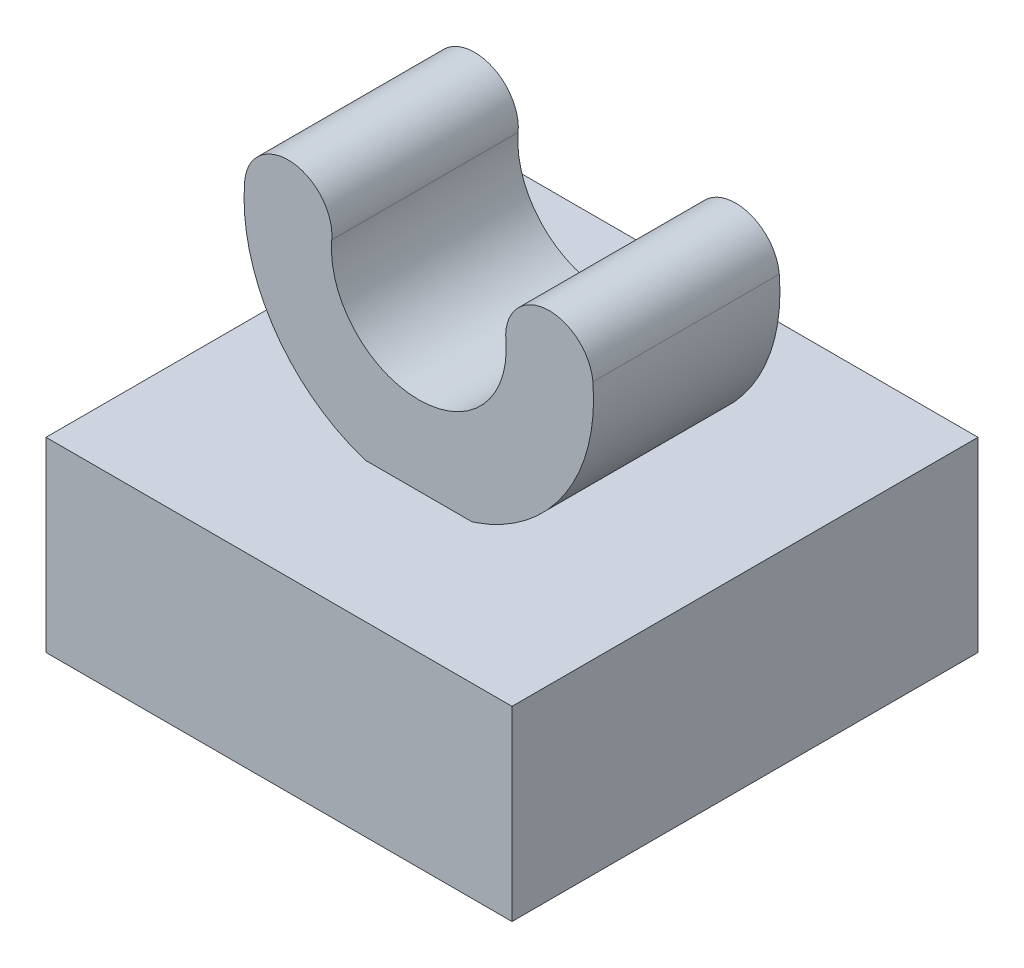
from build123d import *

# Parameters (mm, degrees)
BOSS_EXTRUDE1_DEPTH = 3.2
BOSS_EXTRUDE2_START = 1.6
SKETCH2_W           = 8
SKETCH2_H           = 3.2
BOSS_EXTRUDE2_DEPTH = 4
SKETCH3_W           = 4.8
SKETCH3_H           = 4.8
CUT_EXTRUDE1_DEPTH  = 1.8


with BuildPart() as part:
    # Sketch1 → Boss-Extrude1 (new body)
    with BuildSketch(Plane.XY):
        with BuildLine():
            ThreePointArc((-2.988584094, 0.261467228), (0, -3), (2.988584094, 0.261467228))
            ThreePointArc((2.988584094, 0.261467228), (2.176071264, 0.943246445), (1.494292047, 0.130733614))
            ThreePointArc((1.494292047, 0.130733614), (0, -1.5), (-1.494292047, 0.130733614))
            ThreePointArc((-1.494292047, 0.130733614), (-2.176071264, 0.943246445), (-2.988584094, 0.261467228))
        make_face()
    extrude(amount=BOSS_EXTRUDE1_DEPTH)


with BuildPart() as body_2:
    # Sketch2 → Boss-Extrude2 (new, symmetric)
    with BuildSketch(Plane.XY.offset(BOSS_EXTRUDE2_START)):
        with Locations((0, -4.456753555)):
            Rectangle(SKETCH2_W, SKETCH2_H)
    extrude(amount=BOSS_EXTRUDE2_DEPTH, both=True)

    # Sketch3 → Cut-Extrude1 (cut)
    with BuildSketch(Plane.XZ.offset(6.056753555)):
        with Locations((0, 1.6)):
            Rectangle(SKETCH3_W, SKETCH3_H)
    extrude(amount=-CUT_EXTRUDE1_DEPTH, mode=Mode.SUBTRACT)


solid = Compound([part.part, body_2.part])
